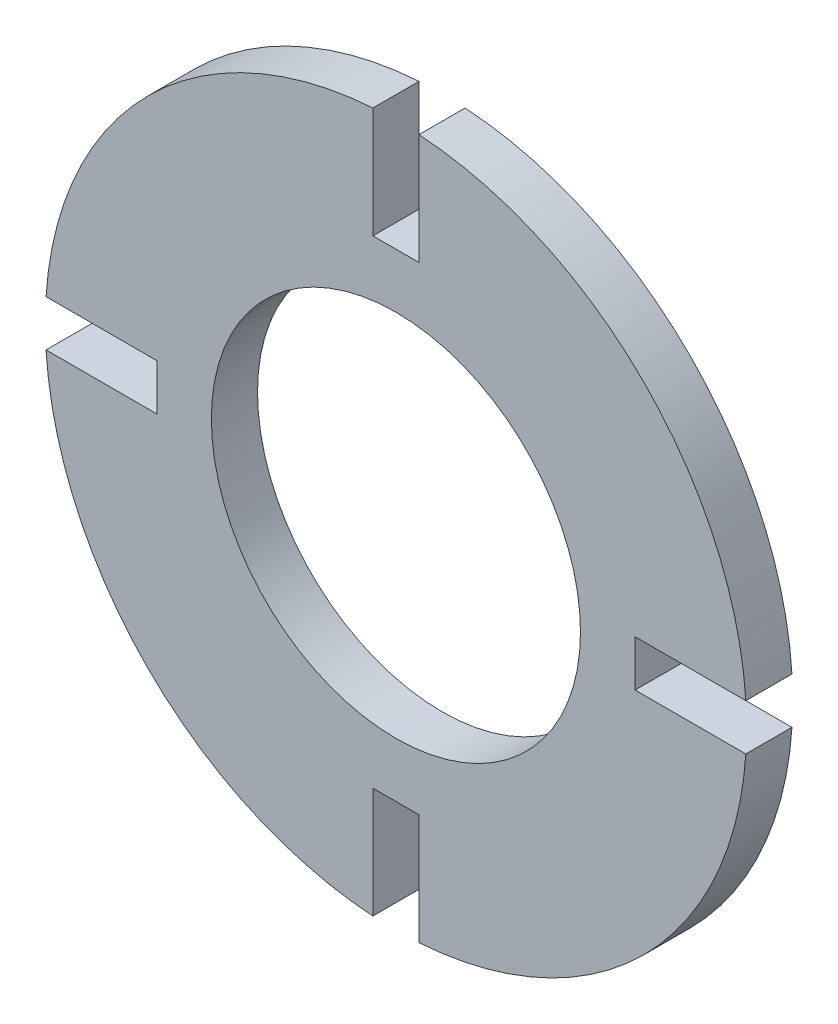
from build123d import *

# Parameters (mm, degrees)
SKETCH1_R           = 20
BOSS_EXTRUDE1_DEPTH = 5


with BuildPart() as part:
    # Sketch1 → Boss-Extrude1 (new body)
    with BuildSketch(Plane.XY):
        with BuildLine():
            Line((2.5, 37.917673979), (2.5, 25.917673979))
            Line((2.5, 25.917673979), (-2.5, 25.917673979))
            Line((-2.5, 25.917673979), (-2.5, 37.917673979))
            ThreePointArc((-2.5, 37.917673979), (-26.870057685, 26.870057685), (-37.917673979, 2.5))
            Line((-37.917673979, 2.5), (-25.917673979, 2.5))
            Line((-25.917673979, 2.5), (-25.917673979, -2.5))
            Line((-25.917673979, -2.5), (-37.917673979, -2.5))
            ThreePointArc((-37.917673979, -2.5), (-26.870057685, -26.870057685), (-2.5, -37.917673979))
            Line((-2.5, -37.917673979), (-2.5, -25.917673979))
            Line((-2.5, -25.917673979), (2.5, -25.917673979))
            Line((2.5, -25.917673979), (2.5, -37.917673979))
            ThreePointArc((2.5, -37.917673979), (26.870057685, -26.870057685), (37.917673979, -2.5))
            Line((37.917673979, -2.5), (25.917673979, -2.5))
            Line((25.917673979, -2.5), (25.917673979, 2.5))
            Line((25.917673979, 2.5), (37.917673979, 2.5))
            ThreePointArc((37.917673979, 2.5), (26.870057685, 26.870057685), (2.5, 37.917673979))
        make_face()
        Circle(SKETCH1_R, mode=Mode.SUBTRACT)
    extrude(amount=BOSS_EXTRUDE1_DEPTH)


solid = part.part
